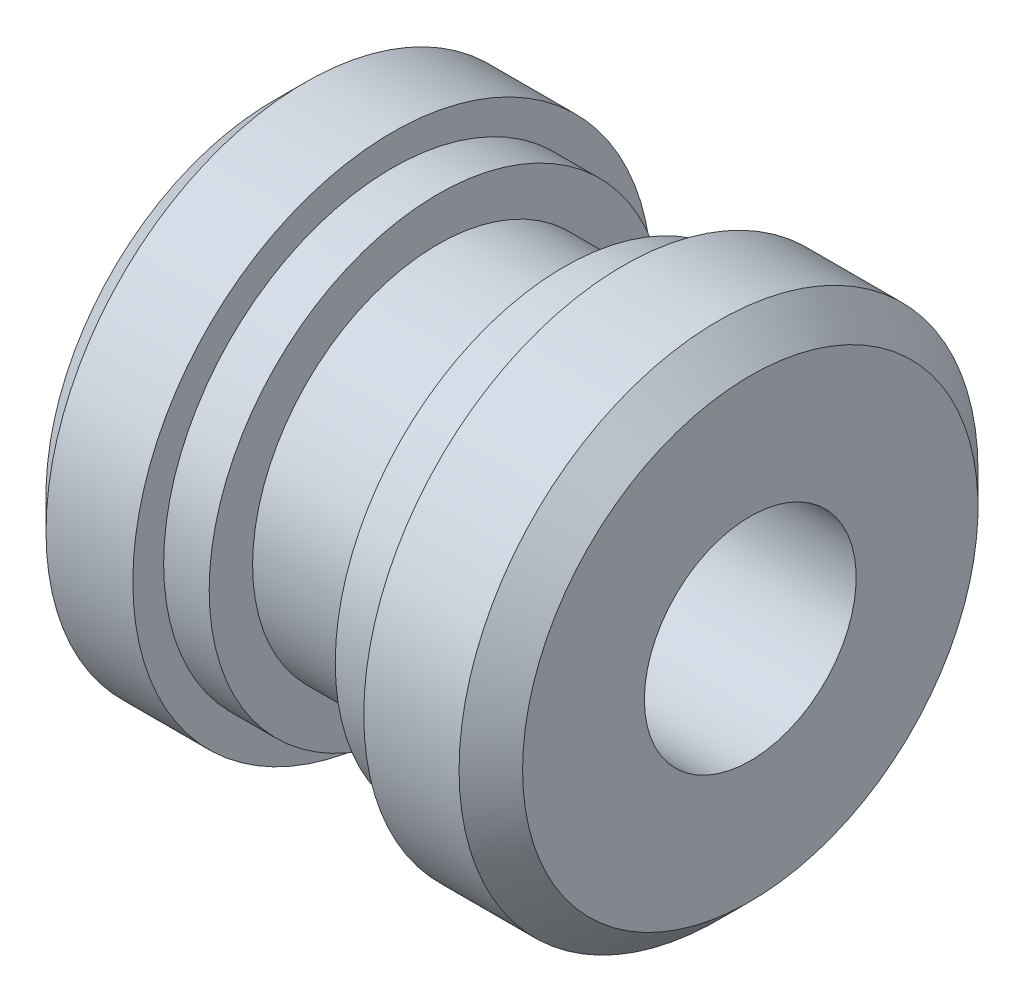
from build123d import *

# Parameters (mm, degrees)
CHAMFER1_SIZE = 3
CHAMFER2_SIZE = 3


with BuildPart() as part:
    # Sketch1 → Revolve1 (revolve)
    with BuildSketch(Plane.XY, mode=Mode.PRIVATE) as revolve1_sk:
        Polygon((0, 10), (0, 24.5), (11.197443099, 24.5), (11.197443099, 21.591227021), (15.498313604, 21.591227021), (15.498313604, 17.490397005), (27.400722676, 17.490397005), (27.400722676, 21.591227021), (33.001856356, 21.591227021), (33.001856356, 24.5), (45, 24.5), (45, 10), align=None)
    revolve(revolve1_sk.sketch.rotate(Axis((0, 0, 0), (1, 0, 0)), 90), axis=Axis((0, 0, 0), (1, 0, 0)))

    # Chamfer1
    chamfer1_edges = [part.edges().sort_by_distance(p)[0] for p in [
        (45, 0, -24.5),
    ]]
    chamfer(chamfer1_edges, length=CHAMFER1_SIZE)

    # Chamfer2
    chamfer2_edges = [part.edges().sort_by_distance(p)[0] for p in [
        (0, 0, -24.5),
    ]]
    chamfer(chamfer2_edges, length=CHAMFER2_SIZE)


solid = part.part
